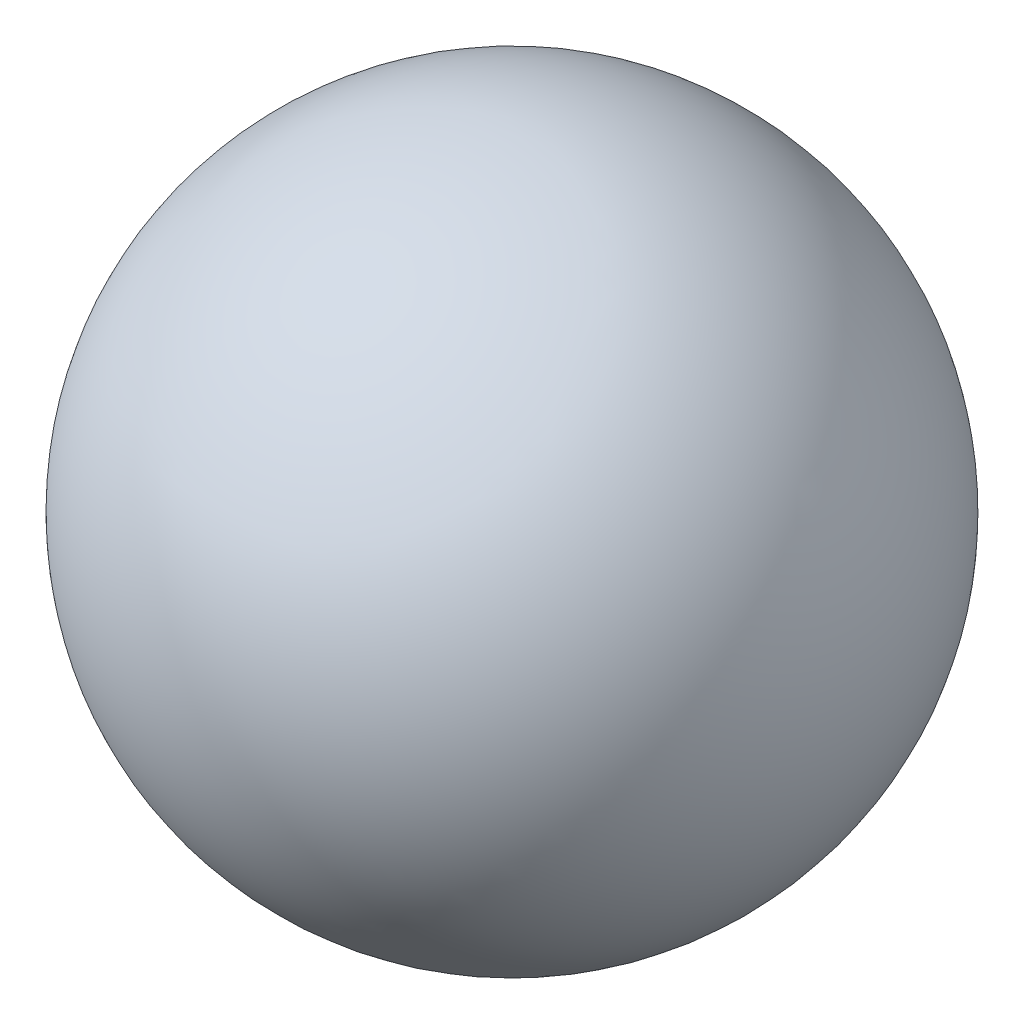
from build123d import *


with BuildPart() as part:
    # Sketch1 → Revolve1 (revolve)
    with BuildSketch(Plane.XY):
        with BuildLine():
            Line((-2.779932675, -1.604994878), (-4.094143968, -2.363755122))
            ThreePointArc((-4.094143968, -2.363755122), (-3.0576582, -2.641480646), (-2.779932675, -1.604994878))
        make_face()
    revolve(axis=Axis((-2.703691727, -1.560977146, 0), (-0.8660254037844431, -0.4999999999999922, 0)))


solid = part.part
